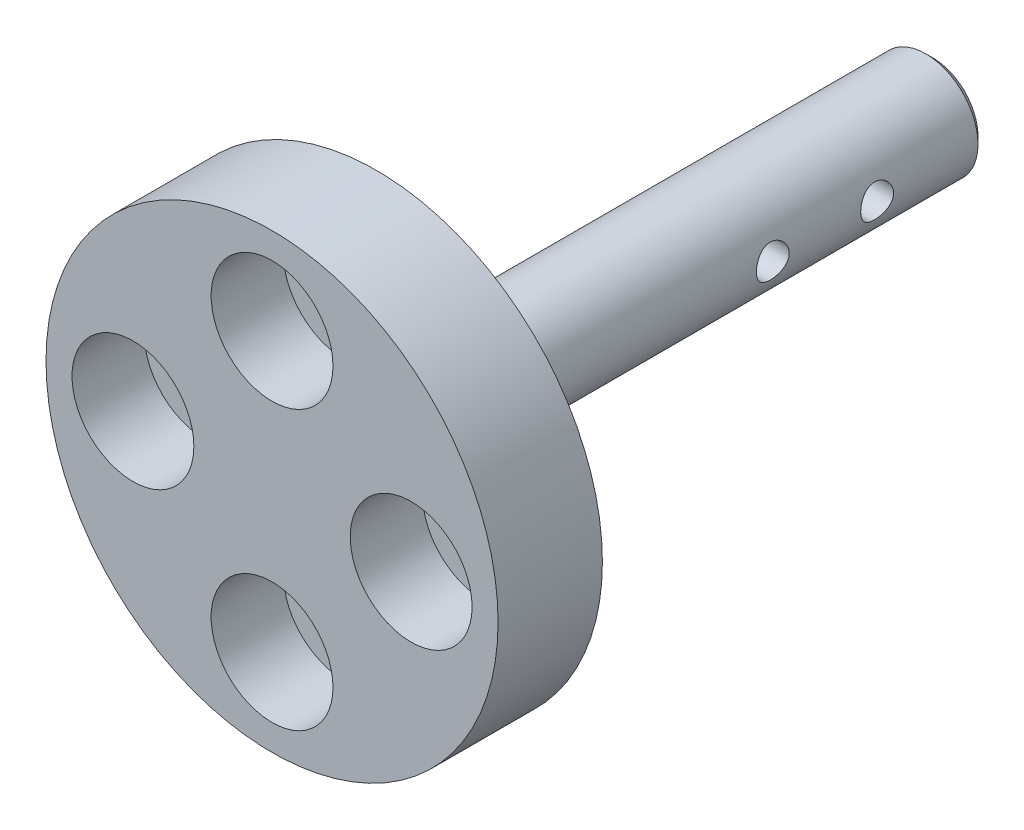
from build123d import *

# Parameters (mm, degrees)
SKETCH1_R               = 20.6375
BOSS_EXTRUDE1_DEPTH     = 9.525
SKETCH3_R               = 5.5626
CUT_EXTRUDE1_DEPTH      = 6.604
CIRPATTERN1_COUNT       = 4
SKETCH10_R              = 4.7625
BOSS_EXTRUDE3_DEPTH     = 50.8
CUT_EXTRUDE3_DEPTH      = 59.587138627
CUT_EXTRUDE3_DEPTH_BACK = 59.587138627
SKETCH11_R              = 1.5
SKETCH13_R              = 3.175
CUT_EXTRUDE4_DEPTH      = 62.13721178
CIRPATTERN2_COUNT       = 4
CHAMFER1_SIZE           = 0.635


with BuildPart() as part:
    # Sketch1 → Boss-Extrude1 (new body)
    with BuildSketch(Plane.XY):
        with Locations(Location((0, 0, 0), (0, 0, 180))):
            Circle(SKETCH1_R)
    extrude(amount=BOSS_EXTRUDE1_DEPTH)

    # Sketch3 → Cut-Extrude1 (cut)
    with BuildSketch(Plane.XY.offset(9.525)):
        with Locations((0, 12.7)):
            Circle(SKETCH3_R)
    cut_extrude1 = extrude(amount=-CUT_EXTRUDE1_DEPTH, mode=Mode.SUBTRACT)

    # CirPattern1: Cut-Extrude1 ×4 about axis
    cirpattern1_axis = Axis((0, 0, 0), (0, 0, 1))
    for i in range(1, CIRPATTERN1_COUNT):
        add(cut_extrude1.rotate(cirpattern1_axis, i * 360 / CIRPATTERN1_COUNT), mode=Mode.SUBTRACT)

    # Sketch10 → Boss-Extrude3 (add)
    with BuildSketch(Plane(origin=(0, 0, 0), x_dir=(-1, 0, 0), z_dir=(0, 0, -1))):
        Circle(SKETCH10_R)
    extrude(amount=BOSS_EXTRUDE3_DEPTH)

    # Sketch11 → Cut-Extrude3 (cut, two sides: drawn at the far end of the back side and taken through both)
    with BuildSketch(Plane(origin=(0, 0, 0), x_dir=(0, 0, -1), z_dir=(1, 0, 0)).offset(-CUT_EXTRUDE3_DEPTH_BACK)):
        with Locations((31.4325, 0)):
            Circle(SKETCH11_R)
        with Locations((40.9575, 0)):
            Circle(SKETCH11_R)
    extrude(amount=CUT_EXTRUDE3_DEPTH + CUT_EXTRUDE3_DEPTH_BACK, mode=Mode.SUBTRACT)

    # Sketch12 → Revolve1 (revolve)
    with BuildSketch(Plane(origin=(0, 0, 0), x_dir=(1, 0, 0), z_dir=(0, 1, 0)), mode=Mode.PRIVATE) as revolve1_sk:
        Polygon((-20.6375, 0), (-4.7625, 7.9375), (-4.7625, 0), align=None)
    revolve(revolve1_sk.sketch.rotate(Axis((0, 0, 0), (0, 0, -1)), 180), axis=Axis((0, 0, 0), (0, 0, -1)))

    # Sketch13 → Cut-Extrude4 (cut, through all)
    with BuildSketch(Plane.XY.offset(2.921)):
        with Locations((-12.7, 0)):
            Circle(SKETCH13_R)
    cut_extrude4 = extrude(amount=-CUT_EXTRUDE4_DEPTH, mode=Mode.SUBTRACT)

    # CirPattern2: Cut-Extrude4 ×4 about axis
    cirpattern2_axis = Axis((0, 0, 0), (0, 0, 1))
    for i in range(1, CIRPATTERN2_COUNT):
        add(cut_extrude4.rotate(cirpattern2_axis, i * 360 / CIRPATTERN2_COUNT), mode=Mode.SUBTRACT)

    # Chamfer1
    chamfer1_edges = [part.edges().sort_by_distance(p)[0] for p in [
        (4.7625, 0, -50.8),
    ]]
    chamfer(chamfer1_edges, length=CHAMFER1_SIZE)


solid = part.part
